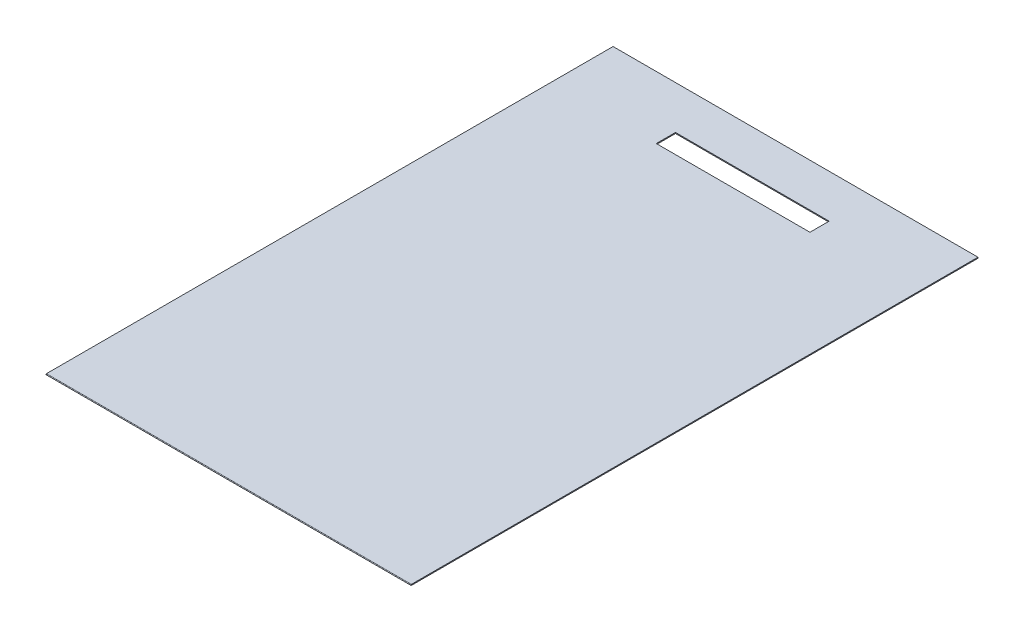
from build123d import *

# Parameters (mm, degrees)
SKETCH1_W           = 190
SKETCH1_H           = 295
SKETCH1_W_2         = 80
SKETCH1_H_2         = 10
BOSS_EXTRUDE1_DEPTH = 0.5
BOSS_EXTRUDE2_DEPTH = 190


with BuildPart() as part:
    # Sketch1 → Boss-Extrude1 (new body)
    with BuildSketch(Plane(origin=(0, 0, 0), x_dir=(1, 0, 0), z_dir=(0, 1, 0))):
        Rectangle(SKETCH1_W, SKETCH1_H)
        with Locations((0, 120)):
            Rectangle(SKETCH1_W_2, SKETCH1_H_2, mode=Mode.SUBTRACT)
    extrude(amount=BOSS_EXTRUDE1_DEPTH)

    # Sketch2 → Boss-Extrude2 (add)
    with BuildSketch(Plane(origin=(95, 0, 0), x_dir=(0, 0, -1), z_dir=(1, 0, 0))):
        with BuildLine():
            Line((-147.5, 0.5), (-147.5, 0))
            ThreePointArc((-147.5, 0), (-147.75, 0.25), (-147.5, 0.5))
        make_face()
    extrude(amount=-BOSS_EXTRUDE2_DEPTH)


solid = part.part
